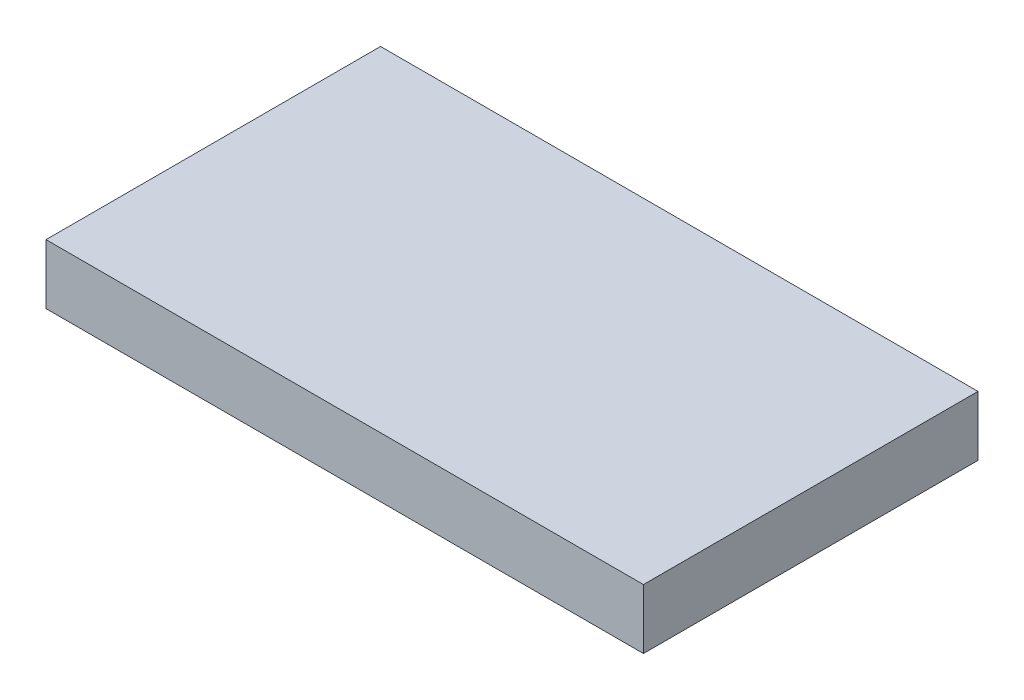
from build123d import *

# Parameters (mm, degrees)
SKETCH1_W           = 127
SKETCH1_H           = 71.12
BOSS_EXTRUDE1_DEPTH = 12.7


with BuildPart() as part:
    # Sketch1 → Boss-Extrude1 (new body)
    with BuildSketch(Plane(origin=(0, 0, 0), x_dir=(1, 0, 0), z_dir=(0, 1, 0))):
        Rectangle(SKETCH1_W, SKETCH1_H)
    extrude(amount=BOSS_EXTRUDE1_DEPTH)


solid = part.part
